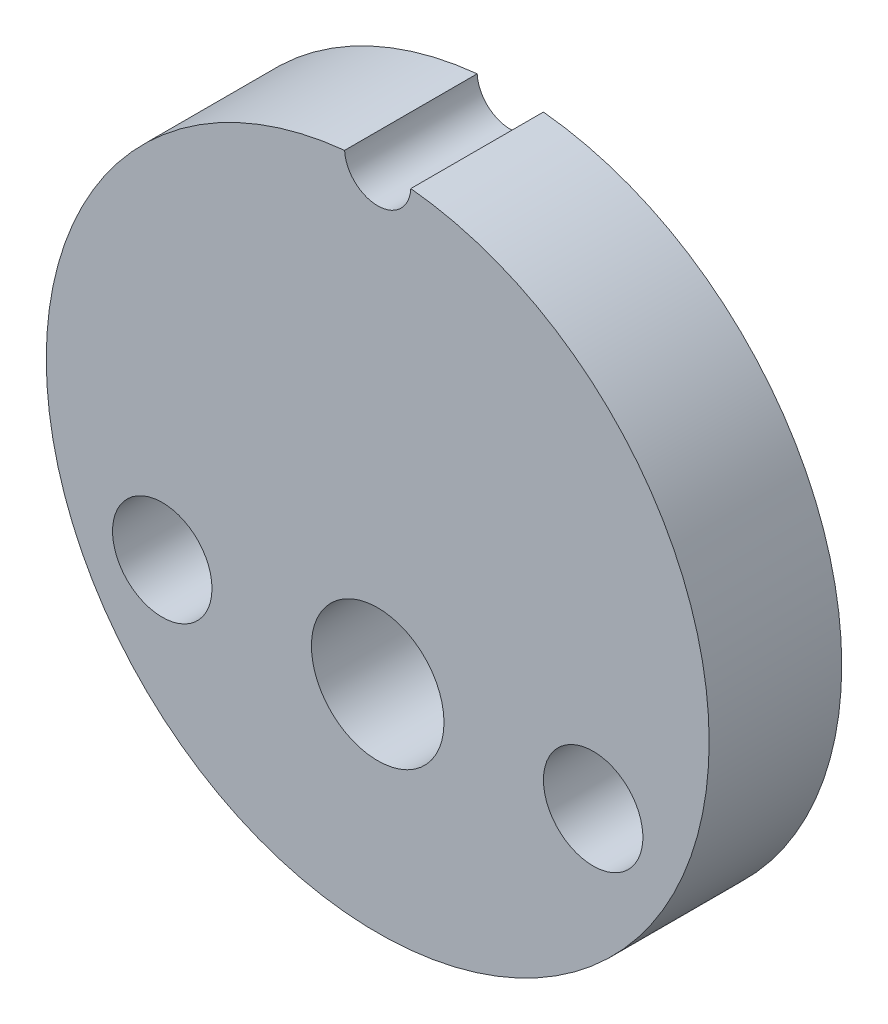
from build123d import *

# Parameters (mm, degrees)
SKETCH_1_R          = 10
SKETCH_1_R_2        = 1.5
SKETCH_1_R_3        = 2
EXTRUDE_1_DEPTH     = 4
SKETCH_2_R          = 1
CUT_EXTRUDE_1_DEPTH = 10


with BuildPart() as part:
    # 草图1 → 凸台-拉伸1 (new body)
    with BuildSketch(Plane.XY):
        with Locations((-0.589945763, 5.342825614)):
            Circle(SKETCH_1_R)
        with Locations((-7.089945763, 1.842825614)):
            Circle(SKETCH_1_R_2, mode=Mode.SUBTRACT)
        with Locations(Location((5.910054237, 1.842825614, 0), (0, 0, 180))):
            Circle(SKETCH_1_R_2, mode=Mode.SUBTRACT)
        with Locations((-0.589945763, 1.842825614)):
            Circle(SKETCH_1_R_3, mode=Mode.SUBTRACT)
    extrude(amount=EXTRUDE_1_DEPTH)

    # 草图2 → 切除-拉伸1 (cut)
    with BuildSketch(Plane.XY.offset(4)):
        with Locations((-0.589945763, 15.342825614)):
            Circle(SKETCH_2_R)
    extrude(amount=-CUT_EXTRUDE_1_DEPTH, mode=Mode.SUBTRACT)


solid = part.part
